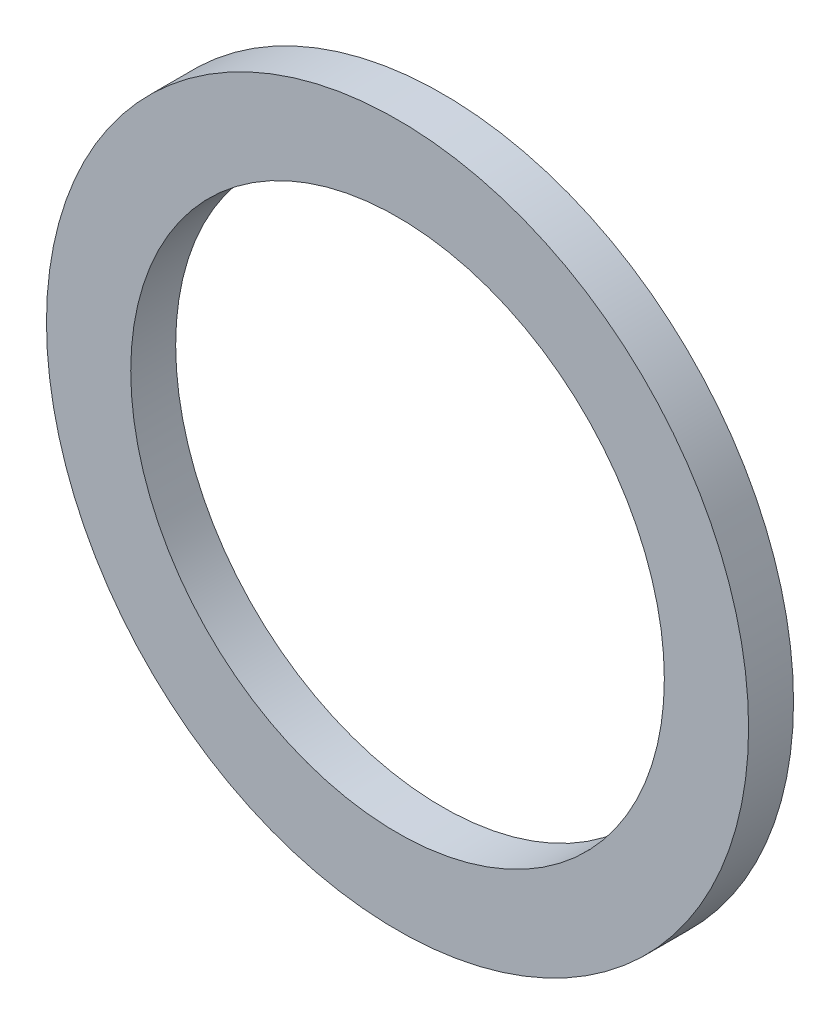
from build123d import *

# Parameters (mm, degrees)
SKETCH2_R           = 3.175
SKETCH2_R_2         = 2.413
BOSS_EXTRUDE1_DEPTH = 0.4064


with BuildPart() as part:
    # Sketch2 → Boss-Extrude1 (new body)
    with BuildSketch(Plane.XY):
        Circle(SKETCH2_R)
        Circle(SKETCH2_R_2, mode=Mode.SUBTRACT)
    extrude(amount=BOSS_EXTRUDE1_DEPTH)


solid = part.part
